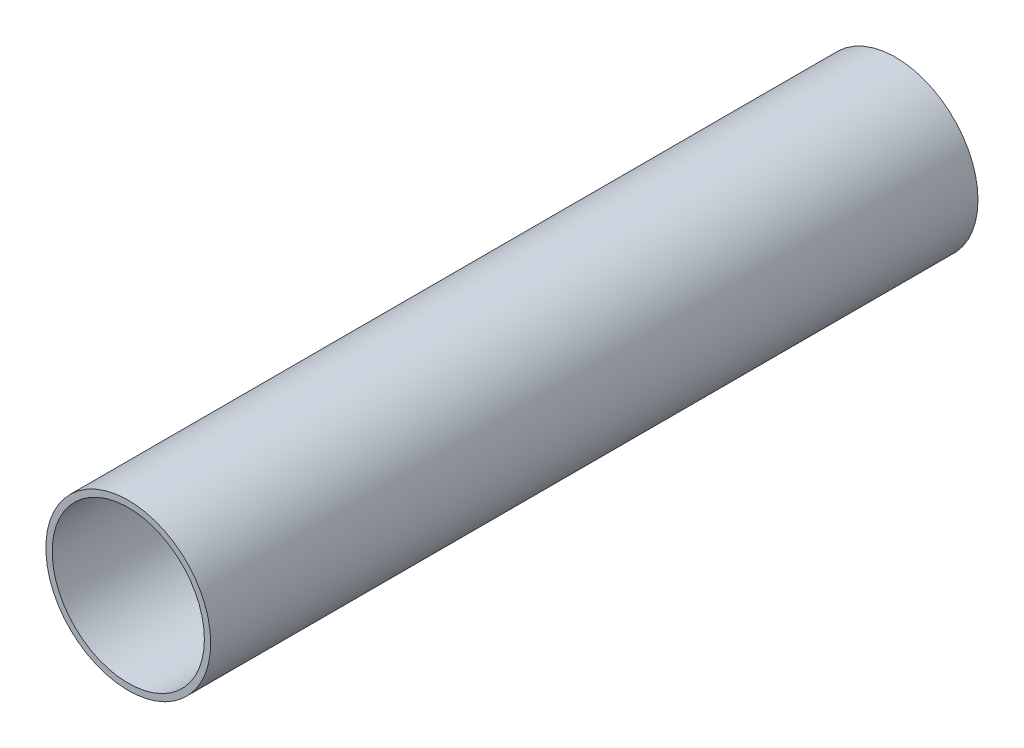
from build123d import *

# Parameters (mm, degrees)
SKETCH1_R           = 26
SKETCH1_R_2         = 24
BOSS_EXTRUDE1_DEPTH = 242


with BuildPart() as part:
    # Sketch1 → Boss-Extrude1 (new body)
    with BuildSketch(Plane.XY):
        Circle(SKETCH1_R)
        Circle(SKETCH1_R_2, mode=Mode.SUBTRACT)
    extrude(amount=BOSS_EXTRUDE1_DEPTH)


solid = part.part
